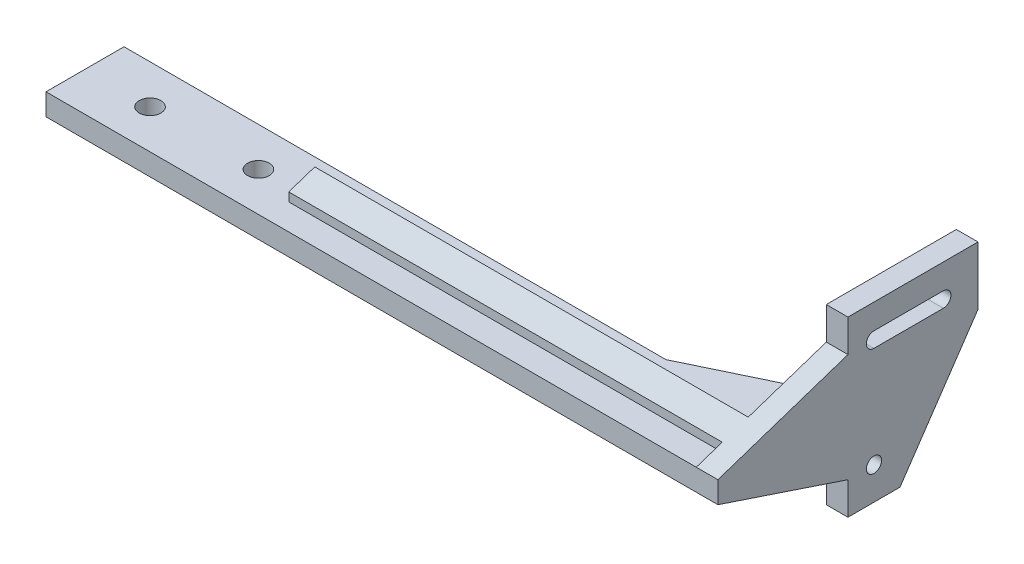
from build123d import *

# Parameters (mm, degrees)
SKETCH_1_W          = 150
SKETCH_1_H          = 18
EXTRUDE_1_DEPTH     = 5
SKETCH_2_R          = 2.5
CUT_EXTRUDE_1_DEPTH = 152.158856836
EXTRUDE_3_DEPTH     = 5
CUT_EXTRUDE_2_REACH = 164.158
SKETCH_8_R          = 1.75
EXTRUDE_4_DEPTH     = 100
EXTRUDE_5_DEPTH     = 5


with BuildPart() as part:
    # 草图1 → 凸台-拉伸1 (new body)
    with BuildSketch(Plane(origin=(0, 0, 0), x_dir=(1, 0, 0), z_dir=(0, 1, 0))):
        with Locations((75, -9)):
            Rectangle(SKETCH_1_W, SKETCH_1_H)
    extrude(amount=EXTRUDE_1_DEPTH)

    # 草图2 → 切除-拉伸1 (cut, through all)
    with BuildSketch(Plane(origin=(0, 5, 0), x_dir=(1, 0, 0), z_dir=(0, 1, 0))):
        with Locations(Location((15, -9, 0), (0, 0, 270))):
            Circle(SKETCH_2_R)
        with Locations(Location((40, -9, 0), (0, 0, 270))):
            Circle(SKETCH_2_R)
    extrude(amount=-CUT_EXTRUDE_1_DEPTH, mode=Mode.SUBTRACT)

    # 草图6 → 凸台-拉伸3 (add)
    with BuildSketch(Plane(origin=(150, 0, 0), x_dir=(0, 0, -1), z_dir=(1, 0, 0))):
        Polygon((12, 15), (12, 22.5), (24, 22.5), (42, 22.5), (42, 9.029805857), (24, -17.5), (12, -17.5), (12, -10), (-18, 0), (-18, 5), align=None)
    extrude(amount=EXTRUDE_3_DEPTH)

    # 草图8 → 切除-拉伸2 (cut, up to next)
    with BuildSketch(Plane(origin=(155, 0, 0), x_dir=(0, 0, -1), z_dir=(1, 0, 0)), mode=Mode.PRIVATE) as cut_extrude_2_sk1:
        with Locations((18, -10)):
            Circle(SKETCH_8_R)
    cut_extrude_2_tool1 = extrude(cut_extrude_2_sk1.sketch, amount=-CUT_EXTRUDE_2_REACH, mode=Mode.PRIVATE) & part.part
    # 草图8 → 切除-拉伸2 (cut, up to next)
    with BuildSketch(Plane(origin=(155, 0, 0), x_dir=(0, 0, -1), z_dir=(1, 0, 0)), mode=Mode.PRIVATE) as cut_extrude_2_sk2:
        with BuildLine():
            Line((18, 16.75), (34, 16.75))
            ThreePointArc((34, 16.75), (35.75, 15), (34, 13.25))
            Line((34, 13.25), (18, 13.25))
            ThreePointArc((18, 13.25), (16.25, 15), (18, 16.75))
        make_face()
    cut_extrude_2_tool2 = extrude(cut_extrude_2_sk2.sketch, amount=-CUT_EXTRUDE_2_REACH, mode=Mode.PRIVATE) & part.part
    add(cut_extrude_2_tool1.solids().sort_by_distance((155, -10, -18))[0], mode=Mode.SUBTRACT)
    add(cut_extrude_2_tool2.solids().sort_by_distance((155, 15, -26))[0], mode=Mode.SUBTRACT)

    # 草图10 → 凸台-拉伸4 (add)
    with BuildSketch(Plane.ZY.offset(-150)):
        Polygon((6, 9), (6, 5), (9, 5), (12, 5), (12, 7), align=None)
    extrude(amount=EXTRUDE_4_DEPTH)

    # 草图11 → 凸台-拉伸5 (add)
    with BuildSketch(Plane(origin=(0, 5, 0), x_dir=(1, 0, 0), z_dir=(0, 1, 0))):
        Polygon((150, 0), (150, 12), (125, 0), align=None)
    extrude(amount=-EXTRUDE_5_DEPTH)


solid = part.part
